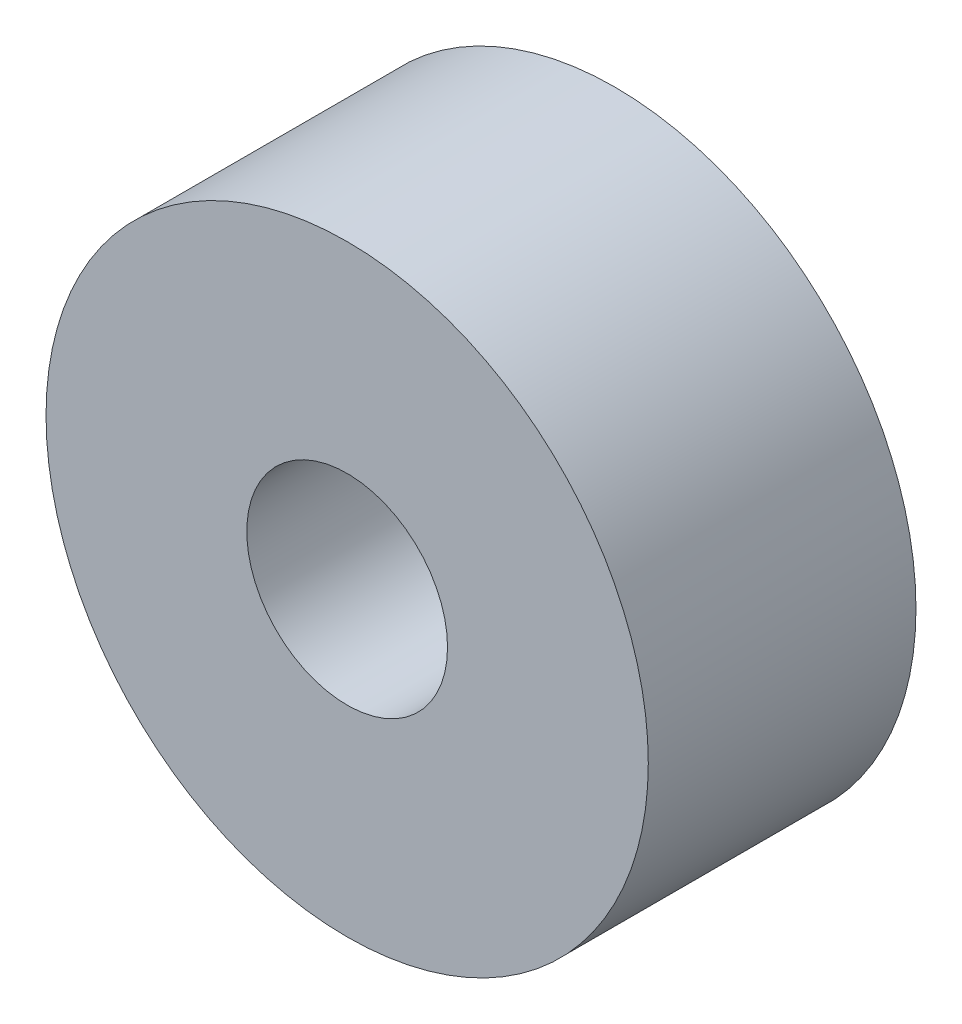
from build123d import *

# Parameters (mm, degrees)
SKETCH_1_R      = 4.5
SKETCH_1_R_2    = 1.5
EXTRUDE_1_DEPTH = 4


with BuildPart() as part:
    # ｽｹｯﾁ1 → ﾎﾞｽ - 押し出し1 (new body)
    with BuildSketch(Plane.XY):
        Circle(SKETCH_1_R)
        Circle(SKETCH_1_R_2, mode=Mode.SUBTRACT)
    extrude(amount=EXTRUDE_1_DEPTH)


solid = part.part
